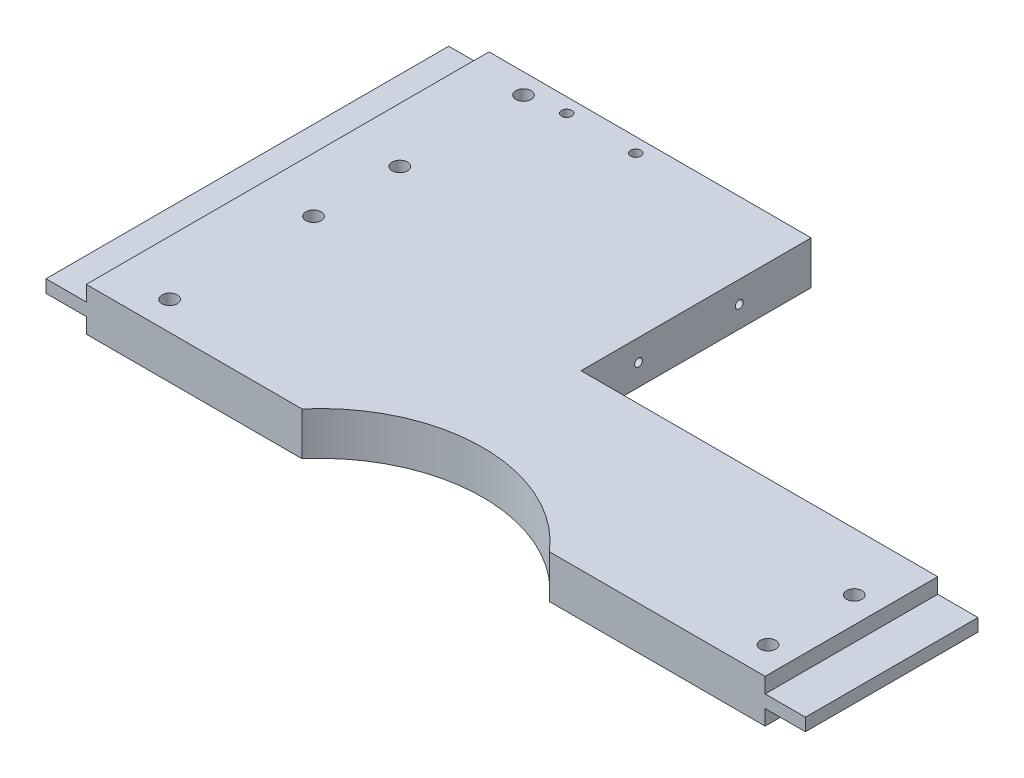
from build123d import *

# Parameters (mm, degrees)
BOSS_EXTRUDE1_DEPTH       = 9.525
SKETCH2_W                 = 17.78
SKETCH2_H                 = 177.8
SKETCH2_H_2               = 76.2
BOSS_EXTRUDE2_DEPTH       = 2.794
F_1_4_CLEARANCE_HOLE1_D   = 6.7564
F_8_CLEARANCE_HOLE1_D     = 4.4958
F_1_4_CLEARANCE_HOLE2_D   = 6.7564
F_8_32_TAPPED_HOLE1_D     = 3.4544
F_8_32_TAPPED_HOLE1_DEPTH = 10.668
F_8_32_TAPPED_HOLE1_TIP   = 1.037806461
F_8_32_TAPPED_HOLE2_D     = 3.4544
F_8_32_TAPPED_HOLE2_DEPTH = 10.668
F_8_32_TAPPED_HOLE2_TIP   = 1.037806461


with BuildPart() as part:
    # Sketch1 → Boss-Extrude1 (new, symmetric)
    with BuildSketch(Plane(origin=(0, 0, 0), x_dir=(1, 0, 0), z_dir=(0, 1, 0))):
        with BuildLine():
            Line((0, 101.6), (-142.24, 101.6))
            Line((-142.24, 101.6), (-142.24, -76.2))
            Line((-142.24, -76.2), (-46.99, -76.2))
            ThreePointArc((-46.99, -76.2), (7.62, -51.017030863), (62.23, -76.2))
            Line((62.23, -76.2), (157.48, -76.2))
            Line((157.48, -76.2), (157.48, 0))
            Line((157.48, 0), (0, 0))
            Line((0, 0), (0, 101.6))
        make_face()
    extrude(amount=BOSS_EXTRUDE1_DEPTH, both=True)

    # Sketch2 → Boss-Extrude2 (add, symmetric)
    with BuildSketch(Plane(origin=(0, 0, 0), x_dir=(1, 0, 0), z_dir=(0, 1, 0))):
        with Locations((-151.13, 12.7)):
            Rectangle(SKETCH2_W, SKETCH2_H)
        with Locations((166.37, -38.1)):
            Rectangle(SKETCH2_W, SKETCH2_H_2)
    extrude(amount=BOSS_EXTRUDE2_DEPTH, both=True)

    # 1/4 Clearance Hole1 (through all)
    with Locations(Plane(origin=(0, 9.525, 0), x_dir=(1, 0, 0), z_dir=(0, 1, 0))):
        with Locations((-118.11, 92.71), (-118.11, 38.1), (-118.11, 0), (-118.11, -63.5)):
            Hole(F_1_4_CLEARANCE_HOLE1_D / 2)

    # #8 Clearance Hole1 (through all)
    with Locations(Plane(origin=(0, 9.525, 0), x_dir=(1, 0, 0), z_dir=(0, 1, 0))):
        with Locations((-101.6, 95.25), (-71.12, 95.25)):
            Hole(F_8_CLEARANCE_HOLE1_D / 2)

    # 1/4 Clearance Hole2 (through all)
    with Locations(Plane(origin=(0, 9.525, 0), x_dir=(1, 0, 0), z_dir=(0, 1, 0))):
        with Locations((146.05, -25.4), (146.05, -63.5)):
            Hole(F_1_4_CLEARANCE_HOLE2_D / 2)

    # #8-32 Tapped Hole1
    with Locations(Plane(origin=(0, 0, 0), x_dir=(-1, 0, 0), z_dir=(0, 0, -1))):
        with Locations((-137.16, 0), (-106.68, 0), (-55.88, 0), (-15.24, 0)):
            Hole(F_8_32_TAPPED_HOLE1_D / 2, depth=F_8_32_TAPPED_HOLE1_DEPTH)
            with Locations((0, 0, -(F_8_32_TAPPED_HOLE1_DEPTH + F_8_32_TAPPED_HOLE1_TIP / 2))):  # 118° drill point
                Cone(0, F_8_32_TAPPED_HOLE1_D / 2, F_8_32_TAPPED_HOLE1_TIP, mode=Mode.SUBTRACT)

    # #8-32 Tapped Hole2
    with Locations(Plane(origin=(0, 0, 0), x_dir=(0, 0, -1), z_dir=(1, 0, 0))):
        with Locations((69.85, 0), (25.4, 0)):
            Hole(F_8_32_TAPPED_HOLE2_D / 2, depth=F_8_32_TAPPED_HOLE2_DEPTH)
            with Locations((0, 0, -(F_8_32_TAPPED_HOLE2_DEPTH + F_8_32_TAPPED_HOLE2_TIP / 2))):  # 118° drill point
                Cone(0, F_8_32_TAPPED_HOLE2_D / 2, F_8_32_TAPPED_HOLE2_TIP, mode=Mode.SUBTRACT)


solid = part.part
